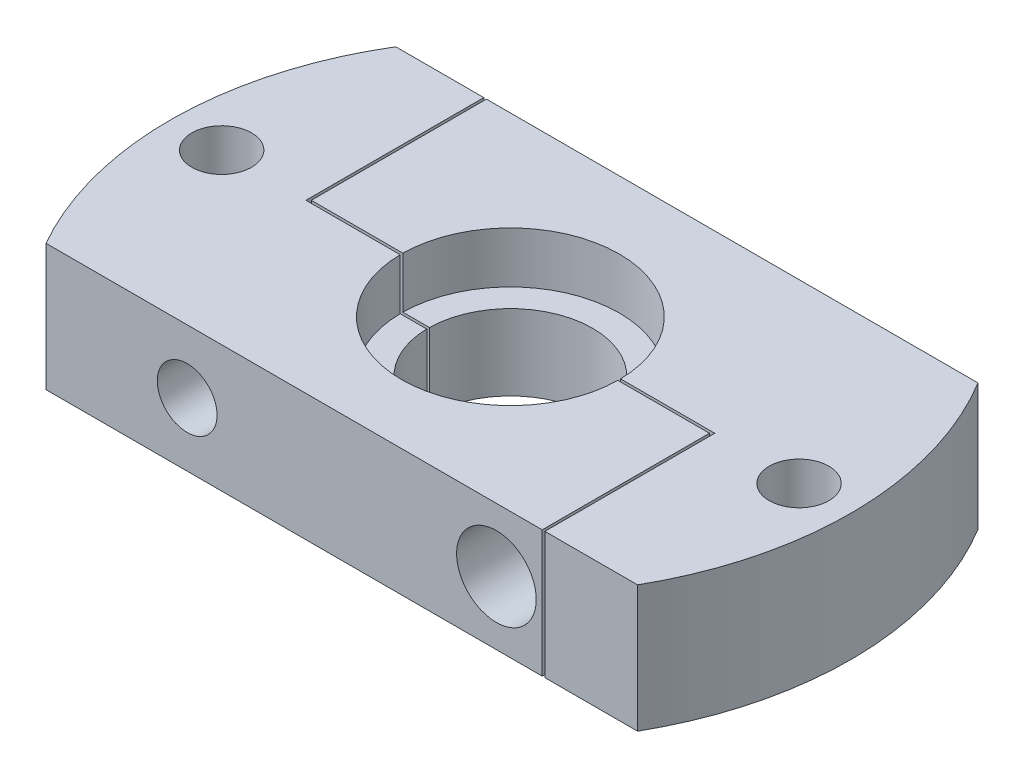
from build123d import *

# Parameters (mm, degrees)
CUT_EXTRUDE1_DEPTH      = 38.510631826
CUT_EXTRUDE1_DEPTH_BACK = 38.510631826
SKETCH14_R              = 2.25
CUT_EXTRUDE4_DEPTH      = 4.25
CUT_EXTRUDE5_START      = -26
SKETCH14_3_R            = 2.25
CUT_EXTRUDE5_DEPTH      = 4.25
SKETCH15_R              = 2.25
CUT_EXTRUDE6_DEPTH      = 5


with BuildPart() as part:
    # Sketch1 → Revolve1 (revolve)
    with BuildSketch(Plane.XY, mode=Mode.PRIVATE) as revolve1_sk:
        Polygon((6.2, 58.45), (6.2, 52.75), (25.65, 52.75), (25.65, 62.3), (8.2, 62.3), (8.2, 58.45), align=None)
    revolve(revolve1_sk.sketch.rotate(Axis((0, 0, 0), (0, 1, 0)), 90), axis=Axis((0, 0, 0), (0, 1, 0)))

    # Sketch2 → Cut-Extrude1 (cut, two sides: drawn at the far end of the back side and taken through both)
    with BuildSketch(Plane(origin=(0, 62.3, 0), x_dir=(1, 0, 0), z_dir=(0, 1, 0)).offset(-CUT_EXTRUDE1_DEPTH_BACK)):
        with BuildLine():
            Line((15.1, -12.7), (-22.285252971, -12.7))
            ThreePointArc((-22.285252971, -12.7), (0, -25.65), (22.285252971, -12.7))
            Line((22.285252971, -12.7), (15.3, -12.7))
            Line((15.3, -12.7), (15.2, -12.7))
            Line((15.2, -12.7), (15.1, -12.7))
        make_face()
        with BuildLine():
            ThreePointArc((21.932453123, 13.3), (0, 25.65), (-21.932453123, 13.3))
            Line((-21.932453123, 13.3), (-15.3, 13.3))
            Line((-15.3, 13.3), (-15.2, 13.3))
            Line((-15.2, 13.3), (-15.1, 13.3))
            Line((-15.1, 13.3), (21.932453123, 13.3))
        make_face()
        with BuildLine():
            Line((-8.199390221, -0.1), (8.199390221, -0.1))
            ThreePointArc((8.199390221, -0.1), (8.199847554, -0.05000093), (8.2, 0))
            Line((8.2, 0), (-8.2, 0))
            ThreePointArc((-8.2, 0), (-8.199847554, -0.05000093), (-8.199390221, -0.1))
        make_face()
        with BuildLine():
            Line((-8.2, 0), (8.2, 0))
            ThreePointArc((8.2, 0), (8.199847554, 0.05000093), (8.199390221, 0.1))
            Line((8.199390221, 0.1), (-8.199390221, 0.1))
            ThreePointArc((-8.199390221, 0.1), (-8.199847554, 0.05000093), (-8.2, 0))
        make_face()
        with BuildLine():
            Line((-15.2, 13.3), (-15.3, 13.3))
            Line((-15.3, 13.3), (-15.3, -0.1))
            Line((-15.3, -0.1), (-8.199390221, -0.1))
            ThreePointArc((-8.199390221, -0.1), (-8.199847554, -0.05000093), (-8.2, 0))
            Line((-8.2, 0), (-15.2, 0))
            Line((-15.2, 0), (-15.2, 13.3))
        make_face()
        with BuildLine():
            Line((-15.1, 13.3), (-15.2, 13.3))
            Line((-15.2, 13.3), (-15.2, 0))
            Line((-15.2, 0), (-8.2, 0))
            ThreePointArc((-8.2, 0), (-8.199847554, 0.05000093), (-8.199390221, 0.1))
            Line((-8.199390221, 0.1), (-15.1, 0.1))
            Line((-15.1, 0.1), (-15.1, 13.3))
        make_face()
        with BuildLine():
            Line((15.1, -0.1), (15.1, -12.7))
            Line((15.1, -12.7), (15.2, -12.7))
            Line((15.2, -12.7), (15.2, 0))
            Line((15.2, 0), (8.2, 0))
            ThreePointArc((8.2, 0), (8.199847554, -0.05000093), (8.199390221, -0.1))
            Line((8.199390221, -0.1), (15.1, -0.1))
        make_face()
        with BuildLine():
            Line((15.2, 0), (15.2, -12.7))
            Line((15.2, -12.7), (15.3, -12.7))
            Line((15.3, -12.7), (15.3, 0.1))
            Line((15.3, 0.1), (8.199390221, 0.1))
            ThreePointArc((8.199390221, 0.1), (8.199847554, 0.05000093), (8.2, 0))
            Line((8.2, 0), (15.2, 0))
        make_face()
    extrude(amount=CUT_EXTRUDE1_DEPTH + CUT_EXTRUDE1_DEPTH_BACK, mode=Mode.SUBTRACT)


with BuildPart() as cut_extrude1_piece_1:
    # of the separate pieces the step leaves, piece 1, a body of its own (cut_extrude1_pieces)
    add(part.part.solids().sort_by_distance((-6.199193496, 52.75, -0.1))[0])


with BuildPart() as cut_extrude1_piece_2:
    # of the separate pieces the step leaves, piece 2, a body of its own (cut_extrude1_pieces)
    add(part.part.solids().sort_by_distance((-6.199193496, 58.45, 0.1))[0])


with BuildPart() as cbore_for_m3_hex_socket_head_cap_screw3_tool:
    # Sketch9 → CBORE for M3 Hex Socket Head Cap Screw3 (revolve)
    with BuildSketch(Plane(origin=(-11.649695111, 57.525, -13.3), x_dir=(0, 1, 0), z_dir=(1, 0, 0))):
        Polygon((0, 0), (0, 26.00025), (1.7, 26.00025), (1.7, 9.4), (3, 9.4), (3, 0), align=None)
    revolve(axis=Axis((-11.649695111, 57.525, -19.65), (0, 0, 1)))


with BuildPart() as cut_extrude1_piece_1_1:
    add(cut_extrude1_piece_1.part)

    # CBORE for M3 Hex Socket Head Cap Screw3: cut by cbore_for_m3_hex_socket_head_cap_screw3_tool
    add(cbore_for_m3_hex_socket_head_cap_screw3_tool.part, mode=Mode.SUBTRACT)


with BuildPart() as cut_extrude1_piece_2_1:
    add(cut_extrude1_piece_2.part)

    # CBORE for M3 Hex Socket Head Cap Screw3: cut by cbore_for_m3_hex_socket_head_cap_screw3_tool
    add(cbore_for_m3_hex_socket_head_cap_screw3_tool.part, mode=Mode.SUBTRACT)


with BuildPart() as cbore_for_m3_hex_socket_head_cap_screw4_tool:
    # Sketch13 → CBORE for M3 Hex Socket Head Cap Screw4 (revolve)
    with BuildSketch(Plane(origin=(11.649695111, 57.525, 12.7), x_dir=(0, -1, 0), z_dir=(1, 0, 0))):
        Polygon((0, 0), (0, 26.00025), (1.7, 26.00025), (1.7, 9.4), (3, 9.4), (3, 0), align=None)
    revolve(axis=Axis((11.649695111, 57.525, 19.05), (0, 0, -1)))


with BuildPart() as cut_extrude1_piece_1_2:
    add(cut_extrude1_piece_1_1.part)

    # CBORE for M3 Hex Socket Head Cap Screw4: cut by cbore_for_m3_hex_socket_head_cap_screw4_tool
    add(cbore_for_m3_hex_socket_head_cap_screw4_tool.part, mode=Mode.SUBTRACT)

    # Sketch14<3> → Cut-Extrude5 (cut)
    with BuildSketch(Plane.XY.offset(12.7).offset(CUT_EXTRUDE5_START)):
        with Locations((11.649695111, 57.525)):
            Circle(SKETCH14_3_R)
    extrude(amount=CUT_EXTRUDE5_DEPTH, mode=Mode.SUBTRACT)


with BuildPart() as cut_extrude1_piece_2_2:
    add(cut_extrude1_piece_2_1.part)

    # CBORE for M3 Hex Socket Head Cap Screw4: cut by cbore_for_m3_hex_socket_head_cap_screw4_tool
    add(cbore_for_m3_hex_socket_head_cap_screw4_tool.part, mode=Mode.SUBTRACT)

    # Sketch14 → Cut-Extrude4 (cut)
    with BuildSketch(Plane.XY.offset(12.7)):
        with Locations((-11.649695111, 57.525)):
            Circle(SKETCH14_R)
    extrude(amount=-CUT_EXTRUDE4_DEPTH, mode=Mode.SUBTRACT)


with BuildPart() as cut_extrude6_tool:
    # Sketch15 → Cut-Extrude6 (new body)
    with BuildSketch(Plane(origin=(0, 62.3, 0), x_dir=(1, 0, 0), z_dir=(0, 1, 0))):
        with Locations(Location((-21.75, 0, 0), (0, 0, 90))):
            Circle(SKETCH15_R)
        with Locations(Location((21.75, 0, 0), (0, 0, 270))):
            Circle(SKETCH15_R)
    extrude(amount=-CUT_EXTRUDE6_DEPTH)


with BuildPart() as cut_extrude1_piece_1_3:
    add(cut_extrude1_piece_1_2.part)

    # Cut-Extrude6: cut by cut_extrude6_tool
    add(cut_extrude6_tool.part, mode=Mode.SUBTRACT)


with BuildPart() as cut_extrude1_piece_2_3:
    add(cut_extrude1_piece_2_2.part)

    # Cut-Extrude6: cut by cut_extrude6_tool
    add(cut_extrude6_tool.part, mode=Mode.SUBTRACT)


solid = Compound([cut_extrude1_piece_1_3.part, cut_extrude1_piece_2_3.part])
